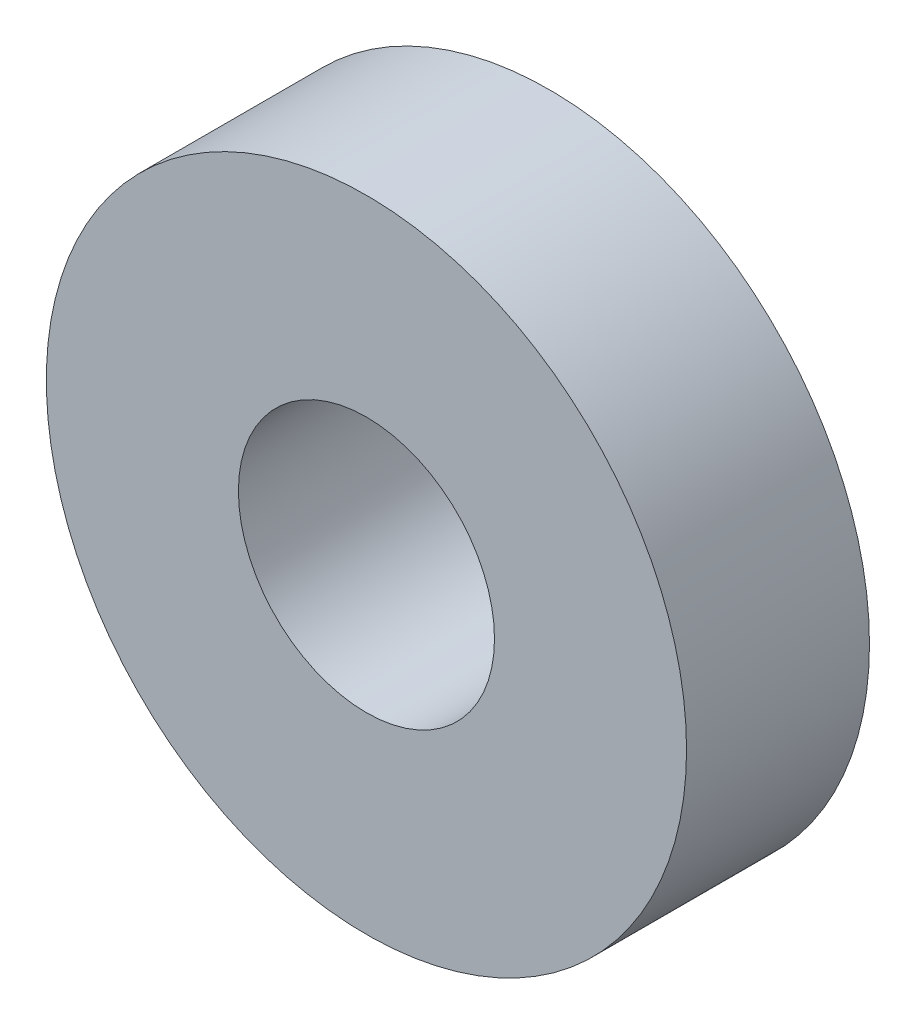
from build123d import *

# Parameters (mm, degrees)
ESQUISSE1_R             = 35
ESQUISSE1_R_2           = 7
BOSS_EXTRU_1_DEPTH      = 20
ESQUISSE2_R             = 14
ENL_V_MAT_EXTRU_1_DEPTH = 5
ESQUISSE3_R             = 4
ENL_V_MAT_EXTRU_3_DEPTH = 5
ESQUISSE8_R             = 14
ENL_V_MAT_EXTRU_4_DEPTH = 25


with BuildPart() as part:
    # Esquisse1 → Boss.-Extru.1 (new body)
    with BuildSketch(Plane.XY):
        Circle(ESQUISSE1_R)
        Circle(ESQUISSE1_R_2, mode=Mode.SUBTRACT)
    extrude(amount=BOSS_EXTRU_1_DEPTH)

    # Esquisse2 → Enlèv. mat.-Extru.1 (cut)
    with BuildSketch(Plane(origin=(0, 0, 0), x_dir=(-1, 0, 0), z_dir=(0, 0, -1))):
        Circle(ESQUISSE2_R)
    extrude(amount=-ENL_V_MAT_EXTRU_1_DEPTH, mode=Mode.SUBTRACT)

    # Esquisse3 → Enlèv. mat.-Extru.3 (cut)
    with BuildSketch(Plane(origin=(0, 0, 0), x_dir=(-1, 0, 0), z_dir=(0, 0, -1))):
        with Locations((-13.588993608, 22.602101614)):
            Circle(ESQUISSE3_R)
        with Locations((13.588993608, 22.602101614)):
            Circle(ESQUISSE3_R)
        with Locations((26.369096609, 0.431843358)):
            Circle(ESQUISSE3_R)
        with Locations((12.841601354, -23.034952123)):
            Circle(ESQUISSE3_R)
        with Locations((-12.82933858, -23.041784138)):
            Circle(ESQUISSE3_R)
        with Locations((-26.369096609, 0.431843358)):
            Circle(ESQUISSE3_R)
    extrude(amount=-ENL_V_MAT_EXTRU_3_DEPTH, mode=Mode.SUBTRACT)

    # Esquisse8 → Enlèv. mat.-Extru.4 (cut)
    with BuildSketch(Plane(origin=(0, 0, 0), x_dir=(-1, 0, 0), z_dir=(0, 0, -1))):
        Circle(ESQUISSE8_R)
    extrude(amount=-ENL_V_MAT_EXTRU_4_DEPTH, mode=Mode.SUBTRACT)


solid = part.part
